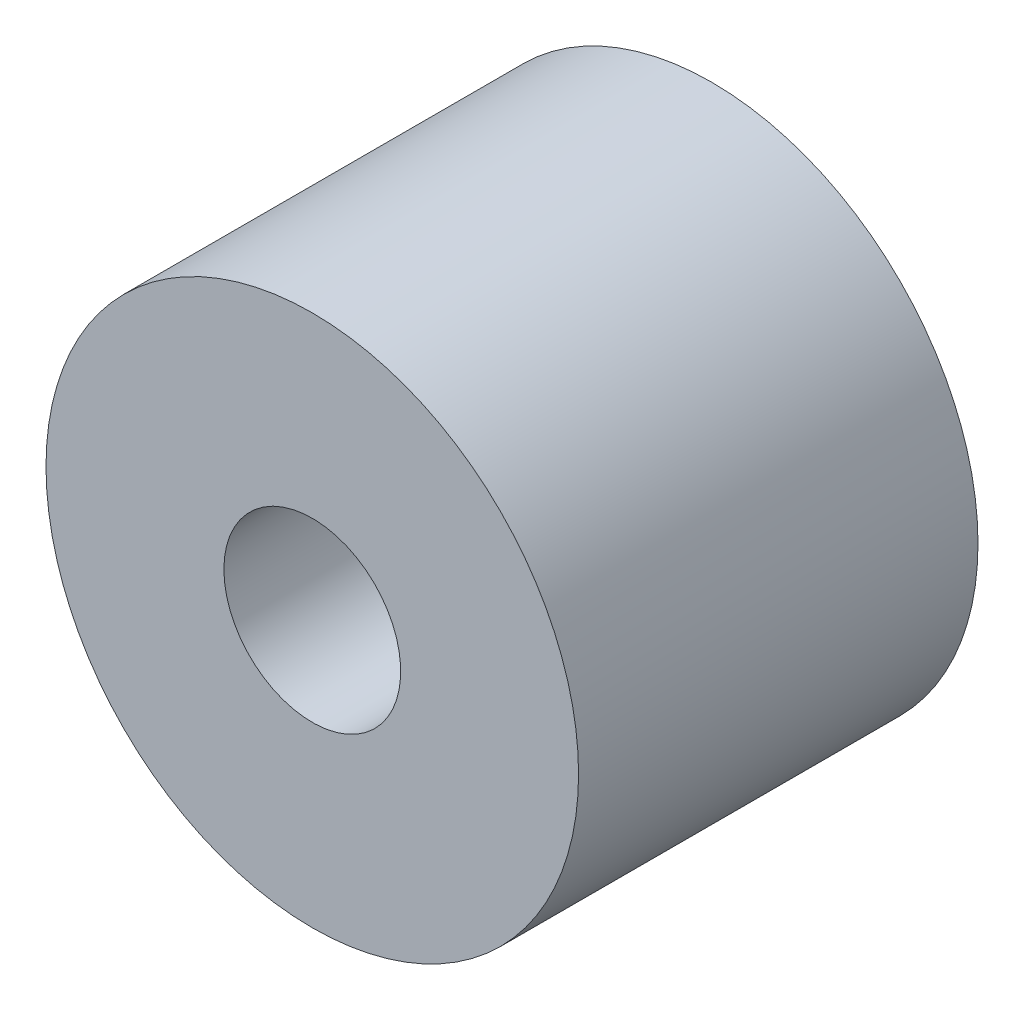
from build123d import *

# Parameters (mm, degrees)
SKETCH1_R      = 6.35
SKETCH1_R_2    = 2.1082
EXTRUDE1_DEPTH = 4.7625


with BuildPart() as part:
    # Sketch1 → Extrude1 (new, symmetric)
    with BuildSketch(Plane.XY):
        with Locations(Location((0, 0, 0), (0, 0, 180))):
            Circle(SKETCH1_R)
        with Locations(Location((0, 0, 0), (0, 0, 180))):
            Circle(SKETCH1_R_2, mode=Mode.SUBTRACT)
    extrude(amount=EXTRUDE1_DEPTH, both=True)


solid = part.part
